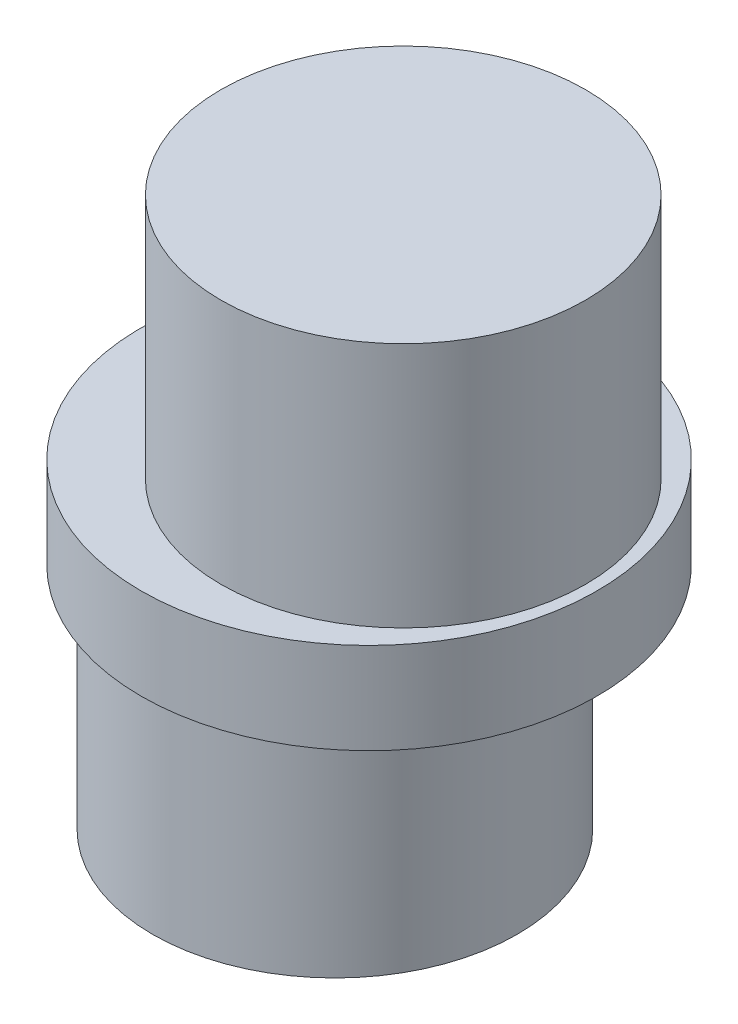
from build123d import *

# Parameters (mm, degrees)
SKETCH1_R           = 7.5
BOSS_EXTRUDE1_DEPTH = 3
SKETCH2_R           = 6
BOSS_EXTRUDE2_DEPTH = 8.1
SKETCH3_R           = 6
BOSS_EXTRUDE3_DEPTH = 8.1


with BuildPart() as part:
    # Sketch1 → Boss-Extrude1 (new body)
    with BuildSketch(Plane(origin=(0, 0, 0), x_dir=(1, 0, 0), z_dir=(0, 1, 0))):
        with Locations(Location((0, 0, 0), (0, 0, 270))):
            Circle(SKETCH1_R)
    extrude(amount=BOSS_EXTRUDE1_DEPTH)

    # Sketch2 → Boss-Extrude2 (add)
    with BuildSketch(Plane(origin=(0, 3, 0), x_dir=(1, 0, 0), z_dir=(0, 1, 0))):
        with Locations(Location((1.125, 0, 0), (0, 0, 270))):
            Circle(SKETCH2_R)
    extrude(amount=BOSS_EXTRUDE2_DEPTH)

    # Sketch3 → Boss-Extrude3 (add)
    with BuildSketch(Plane.XZ):
        with Locations(Location((-1.125, 0, 0), (0, 0, 270))):
            Circle(SKETCH3_R)
    extrude(amount=BOSS_EXTRUDE3_DEPTH)


solid = part.part
